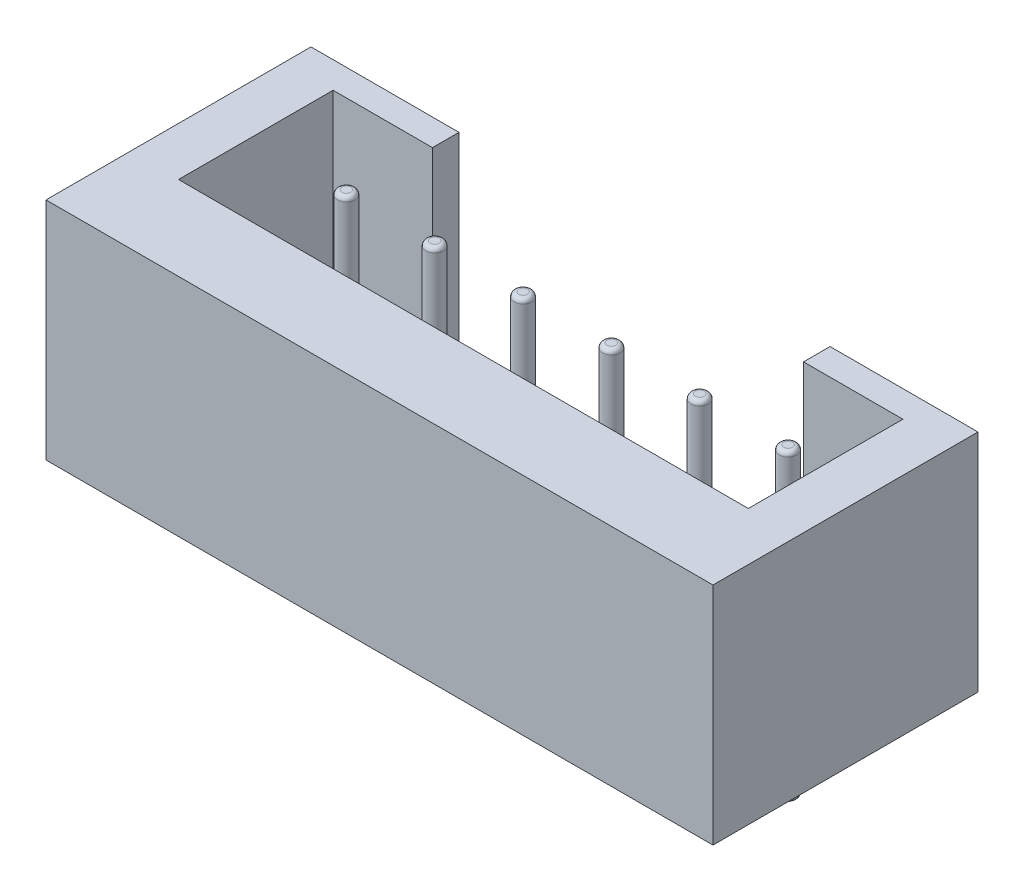
from build123d import *

# Parameters (mm, degrees)
BOSS_EXTRUDE1_DEPTH      = 0.6
BOSS_EXTRUDE2_START      = 0.6
BOSS_EXTRUDE2_DEPTH      = 4.5
BOSS_EXTRUDE3_DEPTH      = 3.9
BOSS_EXTRUDE3_DEPTH_BACK = 3
SKETCH3_R                = 0.2
FILLET1_R                = 0.1


with BuildPart() as part:
    # Sketch2 → Boss-Extrude1 (new body)
    with BuildSketch(Plane(origin=(0, 0, 0), x_dir=(1, 0, 0), z_dir=(0, 1, 0))):
        Polygon((4.2, 3), (7.55, 3), (7.55, -3), (-7.55, -3), (-7.55, 3), (-4.2, 3), align=None)
    extrude(amount=BOSS_EXTRUDE1_DEPTH)

    # Sketch1 → Boss-Extrude2 (add)
    with BuildSketch(Plane(origin=(0, 0, 0), x_dir=(1, 0, 0), z_dir=(0, 1, 0)).offset(BOSS_EXTRUDE2_START)):
        Polygon((-4.2, 2.4), (-4.2, 3), (-7.55, 3), (-7.55, -3), (7.55, -3), (7.55, 3), (4.2, 3), (4.2, 2.4), (6.45, 2.4), (6.45, -1.1), (0.120203435, -1.1), (-0.120203435, -1.1), (-6.45, -1.1), (-6.45, 2.4), align=None)
    extrude(amount=BOSS_EXTRUDE2_DEPTH)

    # Sketch3 → Boss-Extrude3 (add, two sides: drawn at the far end of the back side and taken through both)
    with BuildSketch(Plane(origin=(0, 0.6, 0), x_dir=(1, 0, 0), z_dir=(0, 1, 0)).offset(-BOSS_EXTRUDE3_DEPTH_BACK)):
        with Locations(Location((-4.95, 1.2, 0), (0, 0, 270))):
            Circle(SKETCH3_R)
        with Locations(Location((-2.95, 1.2, 0), (0, 0, 270))):
            Circle(SKETCH3_R)
        with Locations(Location((-0.95, 1.2, 0), (0, 0, 270))):
            Circle(SKETCH3_R)
        with Locations(Location((1.05, 1.2, 0), (0, 0, 270))):
            Circle(SKETCH3_R)
        with Locations(Location((3.05, 1.2, 0), (0, 0, 270))):
            Circle(SKETCH3_R)
        with Locations(Location((5.05, 1.2, 0), (0, 0, 270))):
            Circle(SKETCH3_R)
    extrude(amount=BOSS_EXTRUDE3_DEPTH + BOSS_EXTRUDE3_DEPTH_BACK)

    # Fillet1
    fillet1_edges = [part.edges().sort_by_distance(p)[0] for p in [
        (-4.95, -2.4, -1.4),
        (-4.95, 4.5, -1.4),
        (-2.95, -2.4, -1.4),
        (-2.95, 4.5, -1.4),
        (-0.95, -2.4, -1.4),
        (-0.95, 4.5, -1.4),
        (1.05, -2.4, -1.4),
        (1.05, 4.5, -1.4),
        (3.05, -2.4, -1.4),
        (3.05, 4.5, -1.4),
        (5.05, -2.4, -1.4),
        (5.05, 4.5, -1.4),
    ]]
    fillet(fillet1_edges, radius=FILLET1_R)


solid = part.part
